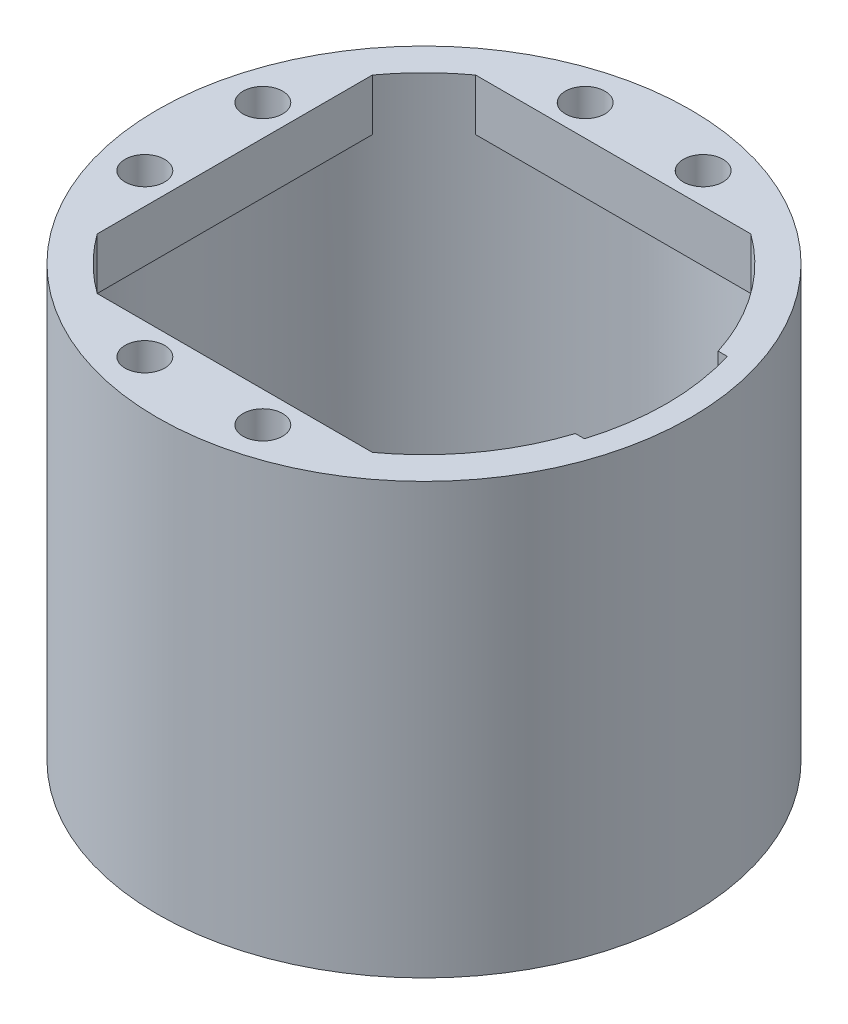
from build123d import *

# Parameters (mm, degrees)
SKETCH1_R           = 31
BOSS_EXTRUDE1_DEPTH = 50
BOSS_EXTRUDE2_DEPTH = 6
SKETCH3_R           = 2.3
CUT_EXTRUDE1_DEPTH  = 4


with BuildPart() as part:
    # Sketch1 → Boss-Extrude1 (new body)
    with BuildSketch(Plane(origin=(0, 0, 0), x_dir=(1, 0, 0), z_dir=(0, 1, 0))):
        with Locations(Location((0, 0, 0), (0, 0, 270))):
            Circle(SKETCH1_R)
        with BuildLine():
            Line((25.902702562, -8.3), (26.950881247, -8.3))
            ThreePointArc((26.950881247, -8.3), (28.2, 0), (26.950881247, 8.3))
            Line((26.950881247, 8.3), (25.902702562, 8.3))
            ThreePointArc((25.902702562, 8.3), (-27.2, 0), (25.902702562, -8.3))
        make_face(mode=Mode.SUBTRACT)
    extrude(amount=-BOSS_EXTRUDE1_DEPTH)

    # Sketch2 → Boss-Extrude2 (add)
    with BuildSketch(Plane(origin=(0, 0, 0), x_dir=(1, 0, 0), z_dir=(0, 1, 0))):
        with BuildLine():
            Line((15.994999219, -22), (-15.994999219, -22))
            ThreePointArc((-15.994999219, -22), (0, -27.2), (15.994999219, -22))
        make_face()
        with BuildLine():
            Line((-15.994999219, 22), (15.994999219, 22))
            ThreePointArc((15.994999219, 22), (0, 27.2), (-15.994999219, 22))
        make_face()
        with BuildLine():
            Line((-22, -15.994999219), (-22, 15.994999219))
            ThreePointArc((-22, 15.994999219), (-27.2, 0), (-22, -15.994999219))
        make_face()
    extrude(amount=-BOSS_EXTRUDE2_DEPTH)

    # Sketch3 → Cut-Extrude1 (cut)
    with BuildSketch(Plane(origin=(0, 0, 0), x_dir=(1, 0, 0), z_dir=(0, 1, 0))):
        with Locations(Location((-25.597034397, 6.858704695, 0), (0, 0, 270))):
            Circle(SKETCH3_R)
        with Locations(Location((-25.597034397, -6.858704695, 0), (0, 0, 270))):
            Circle(SKETCH3_R)
        with Locations(Location((-6.858704695, 25.597034397, 0), (0, 0, 270))):
            Circle(SKETCH3_R)
        with Locations(Location((6.858704695, 25.597034397, 0), (0, 0, 270))):
            Circle(SKETCH3_R)
        with Locations(Location((6.858704695, -25.597034397, 0), (0, 0, 270))):
            Circle(SKETCH3_R)
        with Locations(Location((-6.858704695, -25.597034397, 0), (0, 0, 270))):
            Circle(SKETCH3_R)
    extrude(amount=-CUT_EXTRUDE1_DEPTH, mode=Mode.SUBTRACT)


solid = part.part
